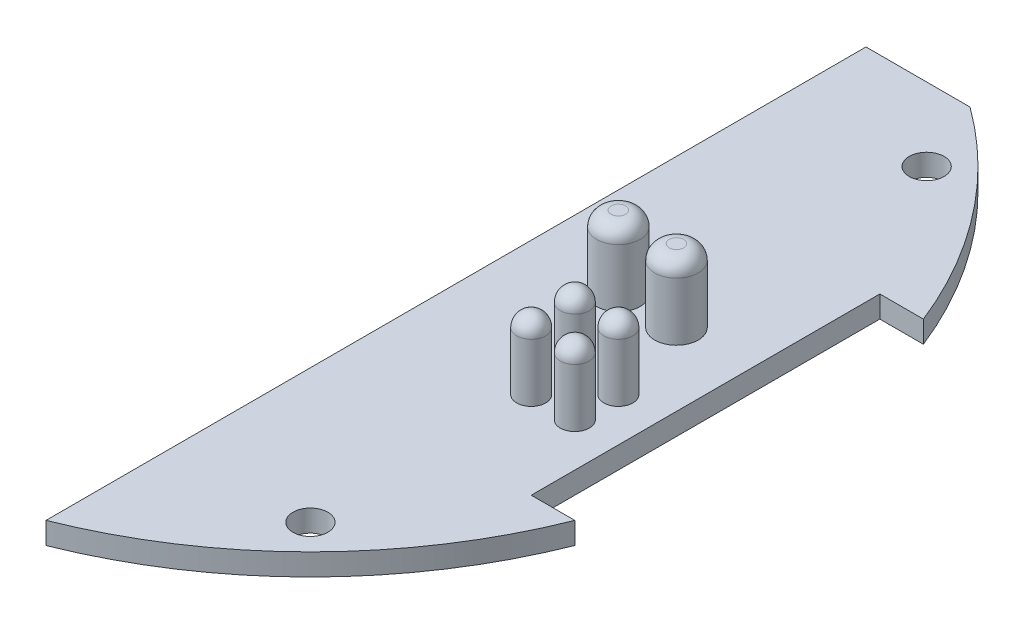
from build123d import *

# Parameters (mm, degrees)
SKETCH_1_R          = 32.5
SKETCH_1_R_2        = 1.2
EXTRUDE_1_DEPTH     = 1.5
CUT_EXTRUDE_1_DEPTH = 46.986411036
CUT_EXTRUDE_2_DEPTH = 43.74049602
SKETCH_4_R          = 1.5
SKETCH_4_R_2        = 1
EXTRUDE_2_DEPTH     = 5
FILLET_1_R          = 1
CUT_EXTRUDE_3_DEPTH = 5


with BuildPart() as part:
    # 草图1 → 凸台-拉伸1 (new body)
    with BuildSketch(Plane(origin=(0, 0, 0), x_dir=(1, 0, 0), z_dir=(0, 1, 0))):
        with Locations(Location((0, 0, 0), (0, 0, 270))):
            Circle(SKETCH_1_R)
        with Locations(Location((21.213203436, 21.213203436, 0), (0, 0, 270))):
            Circle(SKETCH_1_R_2, mode=Mode.SUBTRACT)
        with Locations(Location((21.213203436, -21.213203436, 0), (0, 0, 270))):
            Circle(SKETCH_1_R_2, mode=Mode.SUBTRACT)
        with Locations(Location((-21.213203436, -21.213203436, 0), (0, 0, 270))):
            Circle(SKETCH_1_R_2, mode=Mode.SUBTRACT)
        with Locations(Location((-21.213203436, 21.213203436, 0), (0, 0, 270))):
            Circle(SKETCH_1_R_2, mode=Mode.SUBTRACT)
    extrude(amount=EXTRUDE_1_DEPTH)

    # 草图2 → 切除-拉伸1 (cut, through all)
    with BuildSketch(Plane(origin=(0, 1.5, 0), x_dir=(1, 0, 0), z_dir=(0, 1, 0))):
        with BuildLine():
            Line((30.203476621, 12), (27.203476621, 12))
            Line((27.203476621, 12), (27.203476621, -12))
            Line((27.203476621, -12), (30.203476621, -12))
            ThreePointArc((30.203476621, -12), (32.5, 0), (30.203476621, 12))
        make_face()
        with BuildLine():
            Line((12, -27.203476621), (-12, -27.203476621))
            Line((-12, -27.203476621), (-12, -30.203476621))
            ThreePointArc((-12, -30.203476621), (0, -32.5), (12, -30.203476621))
            Line((12, -30.203476621), (12, -27.203476621))
        make_face()
        with BuildLine():
            Line((-27.203476621, -12), (-27.203476621, 12))
            Line((-27.203476621, 12), (-30.203476621, 12))
            ThreePointArc((-30.203476621, 12), (-32.5, 0), (-30.203476621, -12))
            Line((-30.203476621, -12), (-27.203476621, -12))
        make_face()
        with BuildLine():
            Line((-12, 27.203476621), (12, 27.203476621))
            Line((12, 27.203476621), (12, 30.203476621))
            ThreePointArc((12, 30.203476621), (0, 32.5), (-12, 30.203476621))
            Line((-12, 30.203476621), (-12, 27.203476621))
        make_face()
    extrude(amount=-CUT_EXTRUDE_1_DEPTH, mode=Mode.SUBTRACT)

    # 草图3 → 切除-拉伸2 (cut, through all)
    with BuildSketch(Plane(origin=(0, 1.5, 0), x_dir=(1, 0, 0), z_dir=(0, 1, 0))):
        Polygon((17, 26.25), (-17, 26.25), (-27.149655647, 26.25), (-14.240374978, 46.745445694), (28.149411973, 26.25), align=None)
    extrude(amount=-CUT_EXTRUDE_2_DEPTH, mode=Mode.SUBTRACT)

    # 草图4 → 凸台-拉伸2 (add)
    with BuildSketch(Plane(origin=(0, 1.5, 0), x_dir=(1, 0, 0), z_dir=(0, 1, 0))):
        with Locations(Location((22.203476621, 3, 0), (0, 0, 270))):
            Circle(SKETCH_4_R)
        with Locations(Location((18.203476621, 3, 0), (0, 0, 270))):
            Circle(SKETCH_4_R)
        with Locations(Location((24.203476621, -6, 0), (0, 0, 270))):
            Circle(SKETCH_4_R_2)
        with Locations(Location((24.203476621, -3, 0), (0, 0, 270))):
            Circle(SKETCH_4_R_2)
        with Locations(Location((21.203476621, -6, 0), (0, 0, 270))):
            Circle(SKETCH_4_R_2)
        with Locations(Location((21.203476621, -3, 0), (0, 0, 270))):
            Circle(SKETCH_4_R_2)
    extrude(amount=EXTRUDE_2_DEPTH)

    # 圆角1
    fillet_1_edges = [part.edges().sort_by_distance(p)[0] for p in [
        (22.203476621, 6.5, -4.5),
        (18.203476621, 6.5, -4.5),
        (24.203476621, 6.5, 5),
        (24.203476621, 6.5, 2),
        (21.203476621, 6.5, 5),
        (21.203476621, 6.5, 2),
    ]]
    fillet(fillet_1_edges, radius=FILLET_1_R)

    # 草图5 → 切除-拉伸3 (cut)
    with BuildSketch(Plane(origin=(0, 1.5, 0), x_dir=(1, 0, 0), z_dir=(0, 1, 0))):
        Polygon((12, -30.203476621), (12, 30.744142548), (-38.712969595, 30.744142548), (-38.712969595, -27.203476621), align=None)
    extrude(amount=-CUT_EXTRUDE_3_DEPTH, mode=Mode.SUBTRACT)


with BuildPart() as body_2:
    # of the pieces the cut leaves, the one that is kept (cut_extrude_3_keep)
    add(part.part.solids().sort_by_distance((21.203476621, 5.5, 7))[0])


solid = body_2.part
